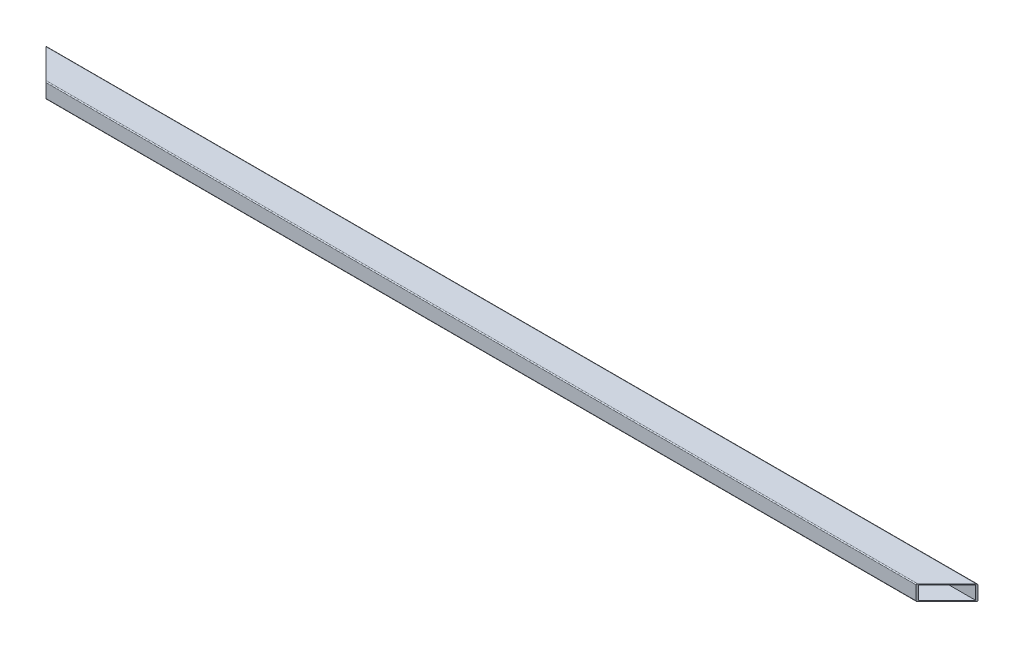
from build123d import *

# Parameters (mm, degrees)
BOSS_EXTRUDE1_DEPTH = 762
SHELL1_T            = -2


with BuildPart() as part:
    # Sketch1 → Boss-Extrude1 (new, symmetric)
    with BuildSketch(Plane(origin=(0, 0, 0), x_dir=(0, 0, -1), z_dir=(1, 0, 0))):
        with BuildLine():
            Line((-23.5, 12.5), (23.5, 12.5))
            ThreePointArc((23.5, 12.5), (24.560660172, 12.060660172), (25, 11))
            Line((25, 11), (25, -11))
            ThreePointArc((25, -11), (24.560660172, -12.060660172), (23.5, -12.5))
            Line((23.5, -12.5), (-23.5, -12.5))
            ThreePointArc((-23.5, -12.5), (-24.560660172, -12.060660172), (-25, -11))
            Line((-25, -11), (-25, 11))
            ThreePointArc((-25, 11), (-24.560660172, 12.060660172), (-23.5, 12.5))
        make_face()
    extrude(amount=BOSS_EXTRUDE1_DEPTH, both=True)

    # Shell1
    shell1_openings = [part.faces().sort_by_distance(p)[0] for p in [
        (762, 0, 0),
        (-762, 0, 0),
    ]]
    offset(amount=SHELL1_T, openings=shell1_openings, kind=Kind.INTERSECTION)

    # SurfaceCut1
    split(bisect_by=Plane(origin=(-362.5, 0, 362.5), x_dir=(0.707106781186551, 0, 0.7071067811865441), z_dir=(-0.7071067811865441, 0, 0.707106781186551)), keep=Keep.BOTTOM)

    # SurfaceCut2
    split(bisect_by=Plane(origin=(362.5, 0, 362.5), x_dir=(-0.707106781186551, 0, 0.7071067811865441), z_dir=(-0.7071067811865441, 0, -0.707106781186551)), keep=Keep.TOP)


solid = part.part
